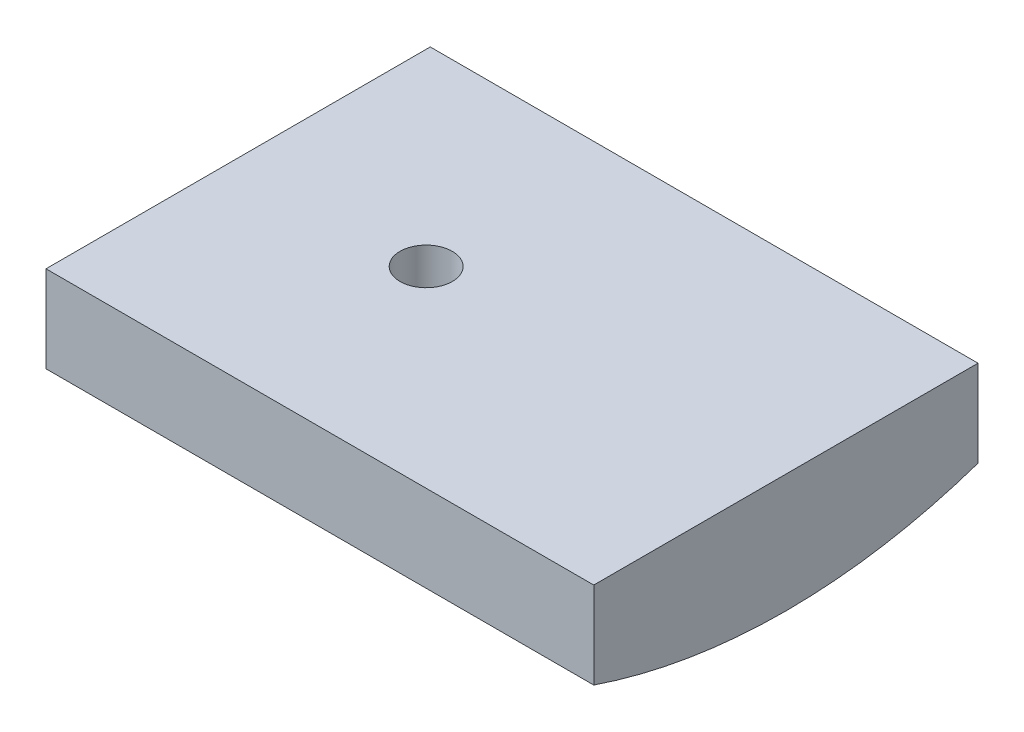
from build123d import *

# Parameters (mm, degrees)
BOSS_EXTRUDE1_DEPTH = 67
SKETCH2_R           = 3.2
CUT_EXTRUDE1_DEPTH  = 73.467233975


with BuildPart() as part:
    # Sketch1 → Boss-Extrude1 (new body)
    with BuildSketch(Plane(origin=(0, 0, 0), x_dir=(0, 0, -1), z_dir=(1, 0, 0))):
        with BuildLine():
            Line((-23.5, -58.2), (23.5, -58.2))
            Line((23.5, -58.2), (23.5, -68.797092962))
            ThreePointArc((23.5, -68.797092962), (0, -72.7), (-23.5, -68.797092962))
            Line((-23.5, -68.797092962), (-23.5, -58.2))
        make_face()
    extrude(amount=BOSS_EXTRUDE1_DEPTH)

    # Sketch2 → Cut-Extrude1 (cut, through all)
    with BuildSketch(Plane(origin=(0, -58.2, 0), x_dir=(1, 0, 0), z_dir=(0, 1, 0))):
        with Locations(Location((23, 0, 0), (0, 0, 270))):
            Circle(SKETCH2_R)
    extrude(amount=-CUT_EXTRUDE1_DEPTH, mode=Mode.SUBTRACT)


solid = part.part
